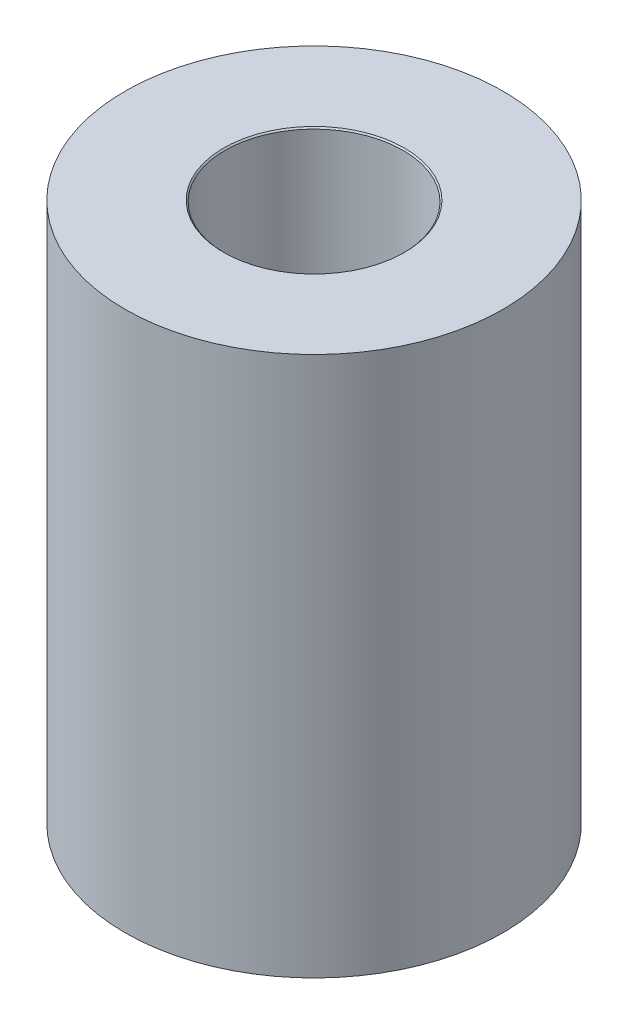
from build123d import *

# Parameters (mm, degrees)
SKETCH1_R           = 3.5
BOSS_EXTRUDE1_DEPTH = 10


with BuildPart() as part:
    # Sketch1 → Boss-Extrude1 (new body)
    with BuildSketch(Plane(origin=(0, 0, 0), x_dir=(1, 0, 0), z_dir=(0, 1, 0))):
        Circle(SKETCH1_R)
    extrude(amount=BOSS_EXTRUDE1_DEPTH)

    # Sketch5 → Tap Drill for M4 Tap1 (revolve, cut)
    with BuildSketch(Plane(origin=(0, 0, 0), x_dir=(0, 0, -1), z_dir=(1, 0, 0))):
        Polygon((0, 0), (0, 10), (1.675, 10), (1.65, 9.975), (1.65, 0.1), (1.75, 0), align=None)
    revolve(axis=Axis((0, -6.35, 0), (0, 1, 0)), mode=Mode.SUBTRACT)


solid = part.part
